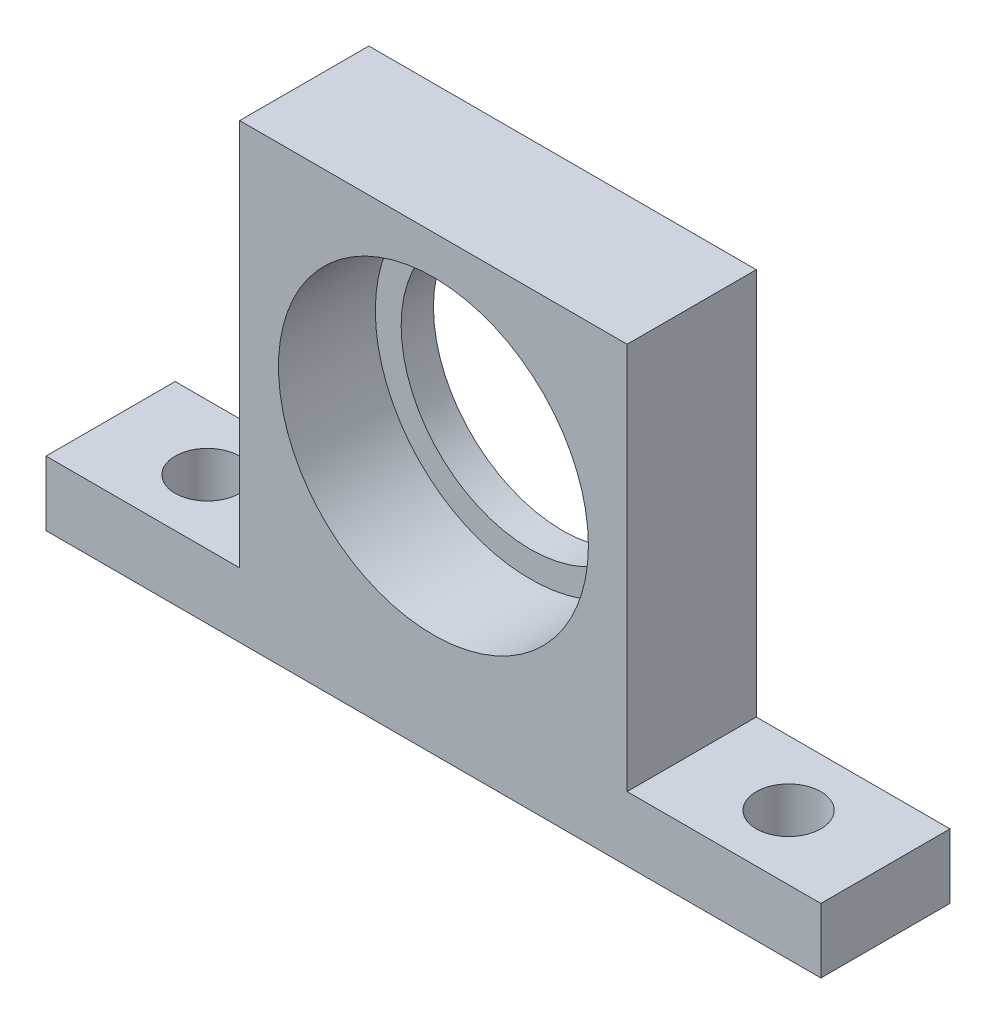
from build123d import *

# Parameters (mm, degrees)
SKETCH1_R                   = 12.7
BOSS_EXTRUDE1_DEPTH         = 12.7
SKETCH2_R                   = 15.24
CUT_EXTRUDE1_DEPTH          = 9.525
F_1_4_0_25_DIAMETER_HOLE1_D = 6.35


with BuildPart() as part:
    # Sketch1 → Boss-Extrude1 (new body)
    with BuildSketch(Plane.XY):
        Polygon((38.1, 0), (-38.1, 0), (-38.1, 6.35), (-19.05, 6.35), (-19.05, 44.45), (19.05, 44.45), (19.05, 6.35), (38.1, 6.35), align=None)
        with Locations((0, 25.4)):
            Circle(SKETCH1_R, mode=Mode.SUBTRACT)
    extrude(amount=BOSS_EXTRUDE1_DEPTH)

    # Sketch2 → Cut-Extrude1 (cut)
    with BuildSketch(Plane.XY.offset(12.7)):
        with Locations((0, 25.4)):
            Circle(SKETCH2_R)
    extrude(amount=-CUT_EXTRUDE1_DEPTH, mode=Mode.SUBTRACT)

    # 1/4 (0.25) Diameter Hole1 (through all)
    with Locations(Plane(origin=(-28.575, 6.35, 6.35), x_dir=(1, 0, 0), z_dir=(0, 1, 0))):
        with Locations((0, 0), (57.15, 0)):
            Hole(F_1_4_0_25_DIAMETER_HOLE1_D / 2)


solid = part.part
